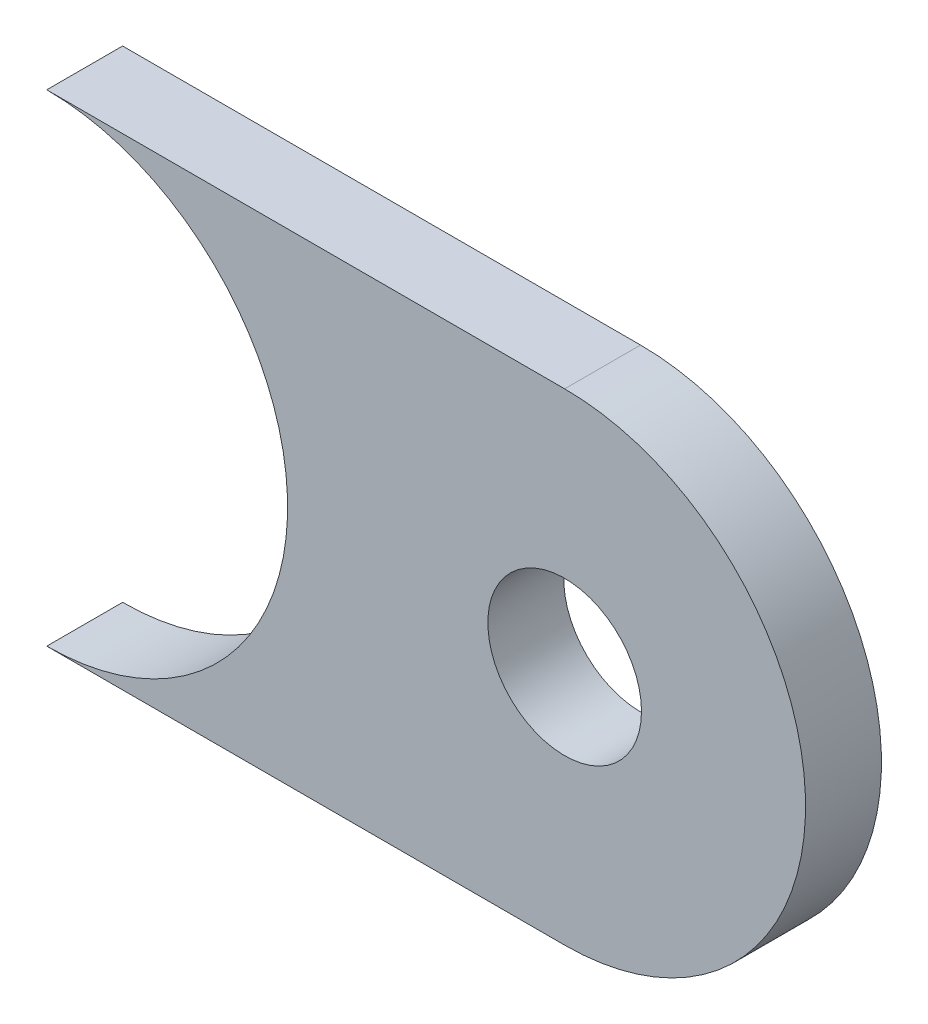
from build123d import *

# Parameters (mm, degrees)
SKETCH1_R           = 4.05
BOSS_EXTRUDE1_DEPTH = 4


with BuildPart() as part:
    # Sketch1 → Boss-Extrude1 (new body)
    with BuildSketch(Plane.XY):
        with BuildLine():
            Line((0, 12.7), (27.305, 12.7))
            ThreePointArc((27.305, 12.7), (40.005, 0), (27.305, -12.7))
            Line((27.305, -12.7), (0, -12.7))
            ThreePointArc((0, -12.7), (12.7, 0), (0, 12.7))
        make_face()
        with Locations((27.305, 0)):
            Circle(SKETCH1_R, mode=Mode.SUBTRACT)
    extrude(amount=BOSS_EXTRUDE1_DEPTH)


solid = part.part
